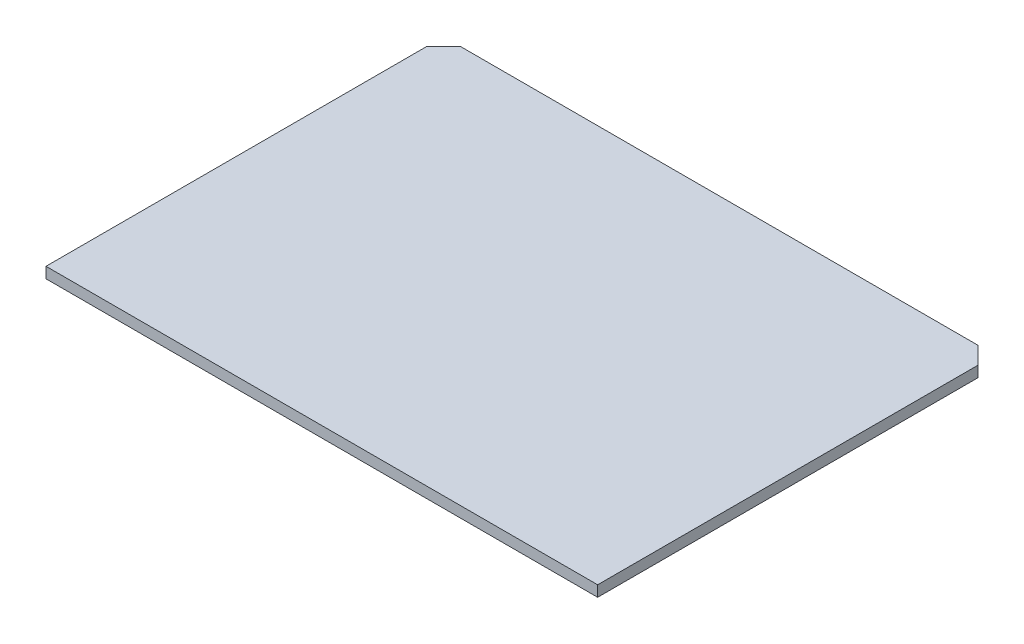
from build123d import *

# Parameters (mm, degrees)
SKETCH1_W           = 81.28
SKETCH1_H           = 58.58
BOSS_EXTRUDE1_DEPTH = 1.6
CHAMFER1_SIZE       = 2.54


with BuildPart() as part:
    # Sketch1 → Boss-Extrude1 (new body)
    with BuildSketch(Plane(origin=(0, 0, 0), x_dir=(1, 0, 0), z_dir=(0, 1, 0))):
        Rectangle(SKETCH1_W, SKETCH1_H)
    extrude(amount=BOSS_EXTRUDE1_DEPTH)

    # Chamfer1
    chamfer1_edges = [part.edges().sort_by_distance(p)[0] for p in [
        (-40.64, 0.8, -29.29),
        (40.64, 0.8, -29.29),
    ]]
    chamfer(chamfer1_edges, length=CHAMFER1_SIZE)


solid = part.part
